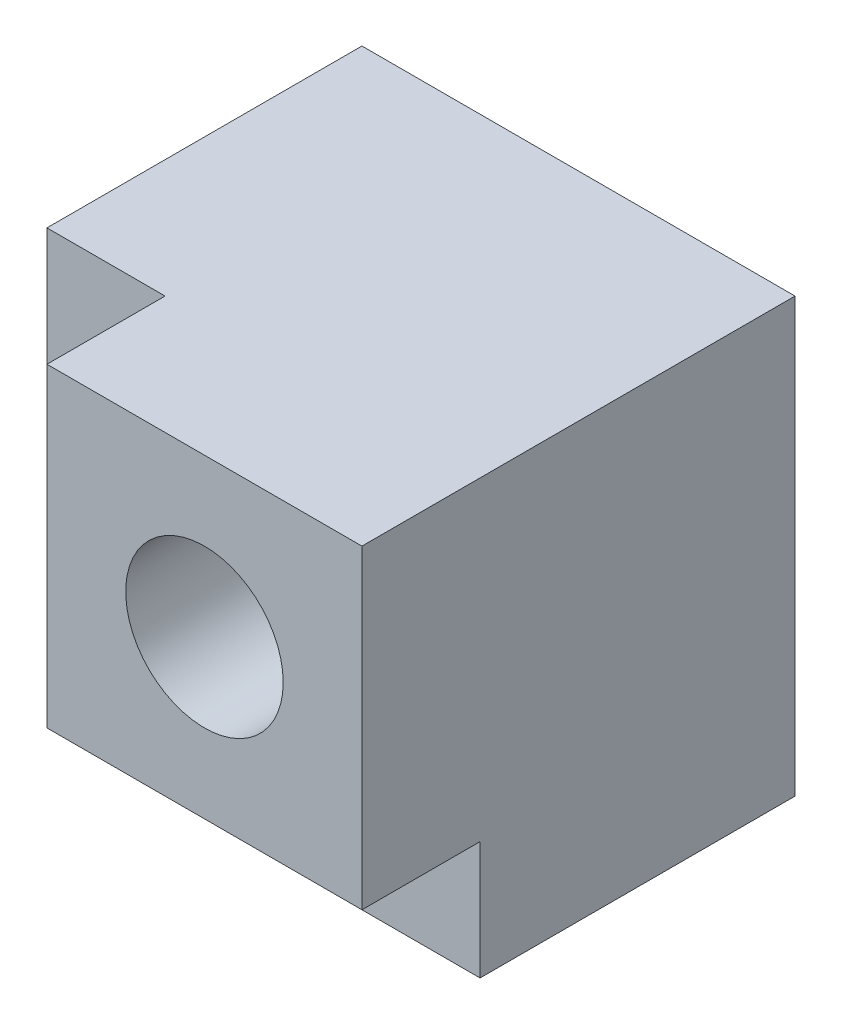
from build123d import *

# Parameters (mm, degrees)
ESQUISSE2_W             = 80
ESQUISSE2_H             = 80
BOSS_EXTRU_1_DEPTH      = 80
ESQUISSE5_W             = 80
ESQUISSE5_H             = 80
BOSS_EXTRU_2_DEPTH      = 30
ESQUISSE6_W             = 80
ESQUISSE6_H             = 80
BOSS_EXTRU_3_DEPTH      = 30
ESQUISSE7_W             = 80
ESQUISSE7_H             = 80
BOSS_EXTRU_4_DEPTH      = 30
ESQUISSE8_R             = 20
ENL_V_MAT_EXTRU_1_DEPTH = 45
ESQUISSE9_R             = 20
ENL_V_MAT_EXTRU_2_DEPTH = 45
ESQUISSE10_R            = 20
ENL_V_MAT_EXTRU_3_DEPTH = 45


with BuildPart() as part:
    # Esquisse2 → Boss.-Extru.1 (new body)
    with BuildSketch(Plane(origin=(0, 0, 0), x_dir=(1, 0, 0), z_dir=(0, 1, 0))):
        Rectangle(ESQUISSE2_W, ESQUISSE2_H)
    extrude(amount=BOSS_EXTRU_1_DEPTH)

    # Esquisse5 → Boss.-Extru.2 (add)
    with BuildSketch(Plane.ZY.offset(40)):
        with Locations((0, 40)):
            Rectangle(ESQUISSE5_W, ESQUISSE5_H)
    extrude(amount=BOSS_EXTRU_2_DEPTH)

    # Esquisse6 → Boss.-Extru.3 (add)
    with BuildSketch(Plane.XY.offset(40)):
        with Locations((0, 40)):
            Rectangle(ESQUISSE6_W, ESQUISSE6_H)
    extrude(amount=BOSS_EXTRU_3_DEPTH)

    # Esquisse7 → Boss.-Extru.4 (add)
    with BuildSketch(Plane.XZ):
        Rectangle(ESQUISSE7_W, ESQUISSE7_H)
    extrude(amount=BOSS_EXTRU_4_DEPTH)

    # Esquisse8 → Enlèv. mat.-Extru.1 (cut)
    with BuildSketch(Plane.ZY.offset(70)):
        with Locations((0, 40)):
            Circle(ESQUISSE8_R)
    extrude(amount=-ENL_V_MAT_EXTRU_1_DEPTH, mode=Mode.SUBTRACT)

    # Esquisse9 → Enlèv. mat.-Extru.2 (cut)
    with BuildSketch(Plane.XY.offset(70)):
        with Locations((0, 40)):
            Circle(ESQUISSE9_R)
    extrude(amount=-ENL_V_MAT_EXTRU_2_DEPTH, mode=Mode.SUBTRACT)

    # Esquisse10 → Enlèv. mat.-Extru.3 (cut)
    with BuildSketch(Plane.XZ.offset(30)):
        with Locations(Location((0, 0, 0), (0, 0, 270))):
            Circle(ESQUISSE10_R)
    extrude(amount=-ENL_V_MAT_EXTRU_3_DEPTH, mode=Mode.SUBTRACT)


solid = part.part
